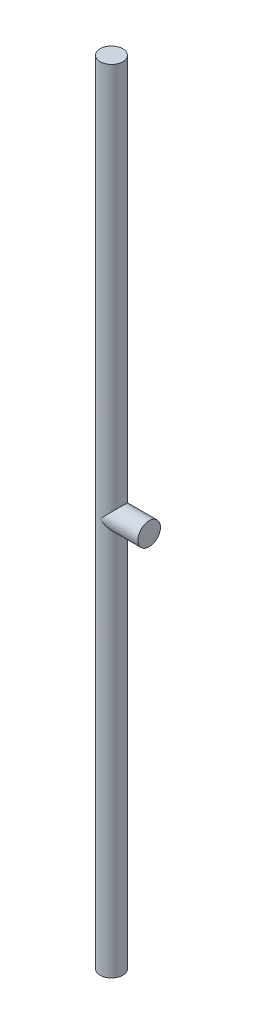
from build123d import *

# Parameters (mm, degrees)
BOSS_EXTRUDE1_DEPTH      = 5250
BOSS_EXTRUDE1_DEPTH_BACK = 5250
SKETCH8_R                = 149.999999974
SKETCH9_R                = 149.999999974
BOSS_EXTRUDE2_DEPTH      = 499.999999998


with BuildPart() as part:
    # Sketch8 → Boss-Extrude1 (new, two sides: drawn at the far end of the back side and taken through both)
    with BuildSketch(Plane(origin=(0, 0, 0), x_dir=(1, 0, 0), z_dir=(0, 1, 0)).offset(-BOSS_EXTRUDE1_DEPTH_BACK)):
        Circle(SKETCH8_R)
    extrude(amount=BOSS_EXTRUDE1_DEPTH + BOSS_EXTRUDE1_DEPTH_BACK)

    # Sketch9 → Boss-Extrude2 (add)
    with BuildSketch(Plane(origin=(0, 0, 0), x_dir=(0, 0, -1), z_dir=(1, 0, 0))):
        Circle(SKETCH9_R)
    extrude(amount=BOSS_EXTRUDE2_DEPTH)


solid = part.part
